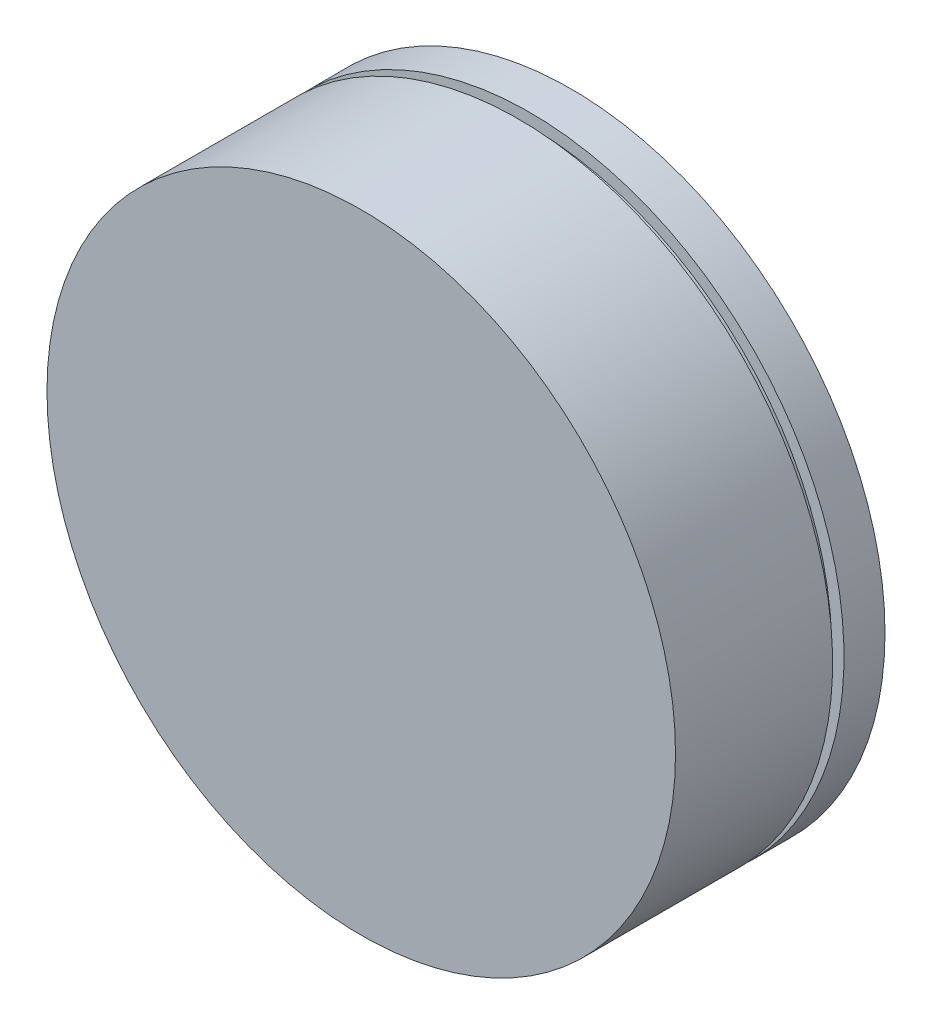
from build123d import *

# Parameters (mm, degrees)
SKETCH1_R           = 38.1
BOSS_EXTRUDE1_DEPTH = 25.4
SKETCH2_W           = 1.476595825
SKETCH2_H           = 1.378223542


with BuildPart() as part:
    # Sketch1 → Boss-Extrude1 (new body)
    with BuildSketch(Plane.XY):
        Circle(SKETCH1_R)
    extrude(amount=BOSS_EXTRUDE1_DEPTH)

    # Sketch2 → Cut-Revolve1 (revolve, cut)
    with BuildSketch(Plane(origin=(0, 0, 0), x_dir=(1, 0, 0), z_dir=(0, 1, 0))):
        with Locations((-37.361702088, -5.660888229)):
            Rectangle(SKETCH2_W, SKETCH2_H)
    revolve(axis=Axis((0, 0, 0), (0, 0, 1)), mode=Mode.SUBTRACT)


solid = part.part
